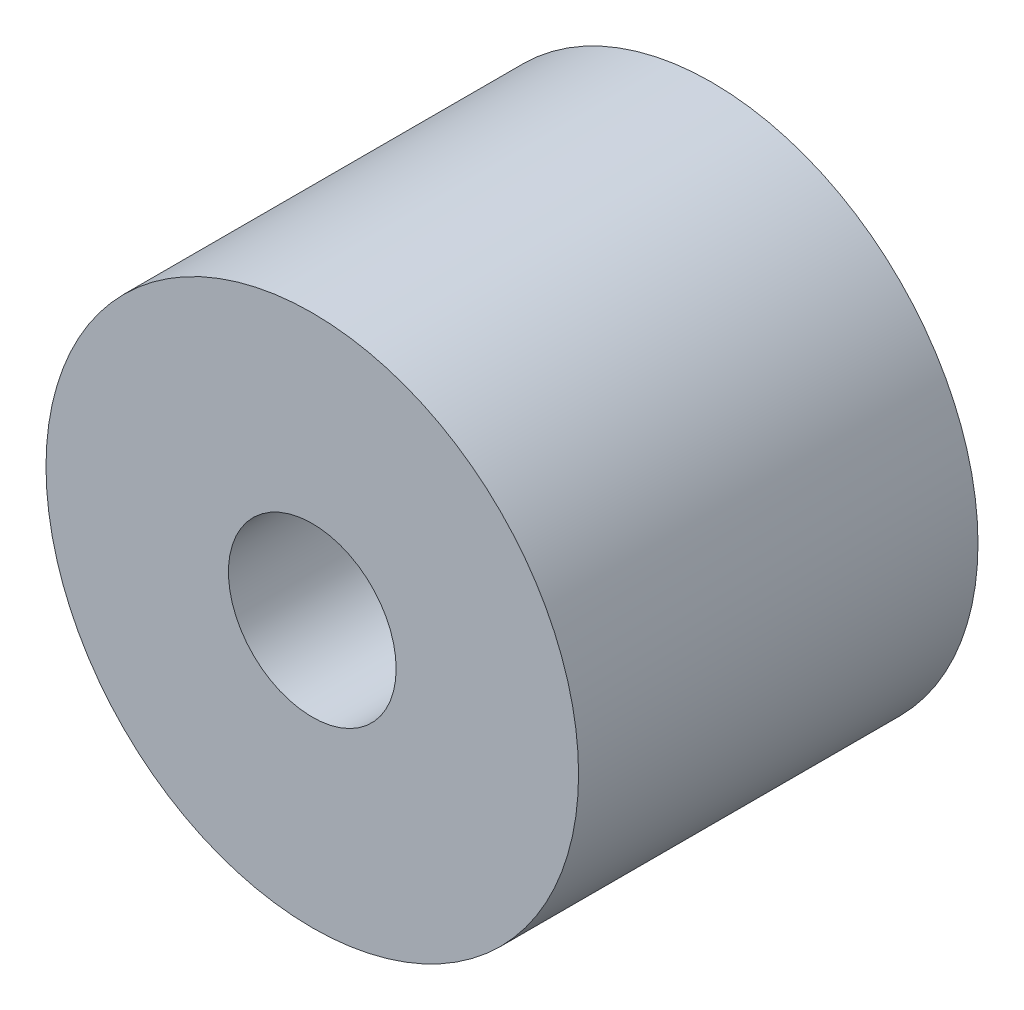
from build123d import *

# Parameters (mm, degrees)
SKETCH1_R           = 6.35
SKETCH1_R_2         = 4.7625
BOSS_EXTRUDE1_DEPTH = 9.525
BOSS_EXTRUDE2_START = -9.525
SKETCH2_R           = 4.7625
SKETCH2_R_2         = 2
BOSS_EXTRUDE2_DEPTH = 9.525


with BuildPart() as part:
    # Sketch1 → Boss-Extrude1 (new body)
    with BuildSketch(Plane.XY):
        Circle(SKETCH1_R)
        Circle(SKETCH1_R_2, mode=Mode.SUBTRACT)
    extrude(amount=BOSS_EXTRUDE1_DEPTH)

    # Sketch2 → Boss-Extrude2 (add)
    with BuildSketch(Plane.XY.offset(9.525).offset(BOSS_EXTRUDE2_START)):
        Circle(SKETCH2_R)
        Circle(SKETCH2_R_2, mode=Mode.SUBTRACT)
    extrude(amount=BOSS_EXTRUDE2_DEPTH)


solid = part.part
